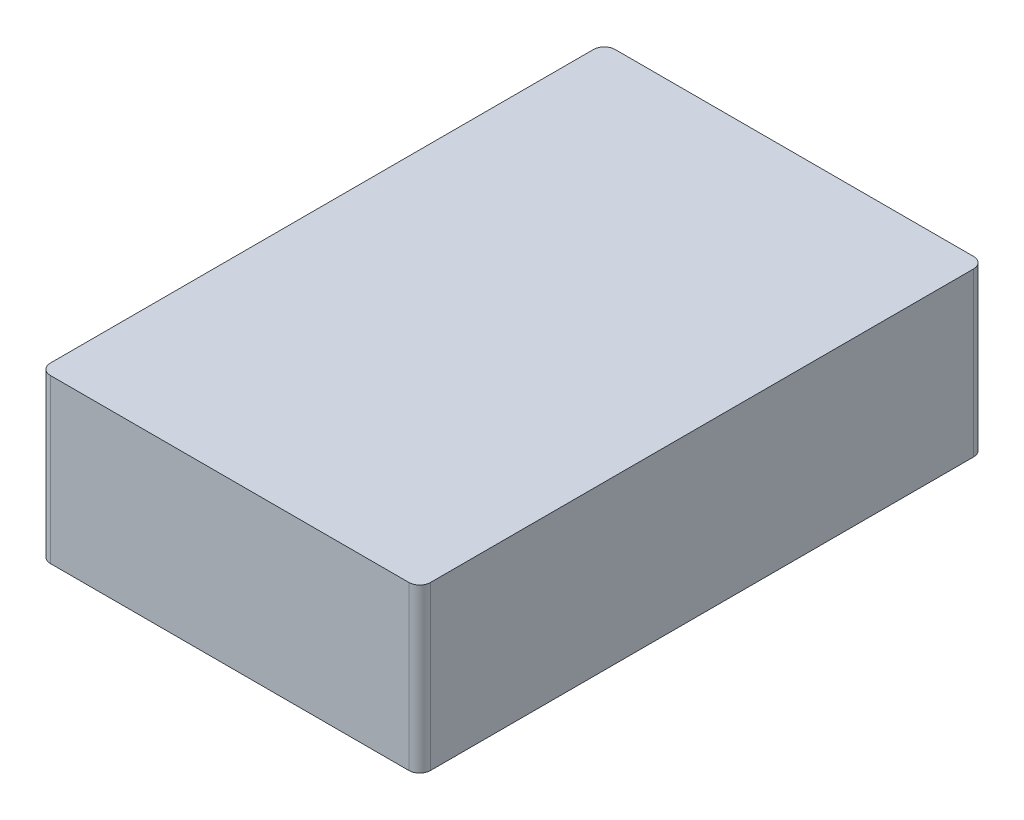
from build123d import *

# Parameters (mm, degrees)
SKETCH1_W           = 35
SKETCH1_H           = 52
BOSS_EXTRUDE1_DEPTH = 15
FILLET1_R           = 1


with BuildPart() as part:
    # Sketch1 → Boss-Extrude1 (new body)
    with BuildSketch(Plane(origin=(0, 0, 0), x_dir=(1, 0, 0), z_dir=(0, 1, 0))):
        Rectangle(SKETCH1_W, SKETCH1_H)
    extrude(amount=BOSS_EXTRUDE1_DEPTH)

    # Fillet1
    fillet1_edges = [part.edges().sort_by_distance(p)[0] for p in [
        (17.5, 7.5, 26),
        (-17.5, 7.5, 26),
        (-17.5, 7.5, -26),
        (17.5, 7.5, -26),
    ]]
    fillet(fillet1_edges, radius=FILLET1_R)


solid = part.part
